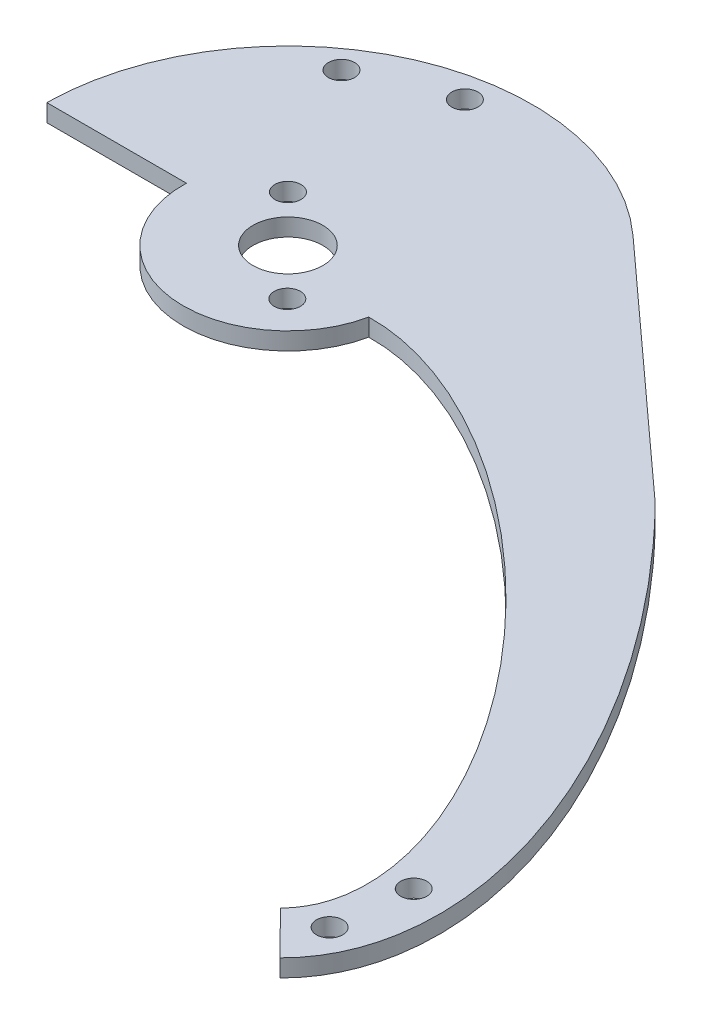
from build123d import *

# Parameters (mm, degrees)
SKETCH_1_R          = 4
SKETCH_1_R_2        = 1.5
EXTRUDE_1_DEPTH     = 2
SKETCH_2_R          = 1.5
CUT_EXTRUDE_2_DEPTH = 104.45632216


with BuildPart() as part:
    # Эскиз1 → Бобышка-Вытянуть1 (new body)
    with BuildSketch(Plane(origin=(0, 0, 0), x_dir=(1, 0, 0), z_dir=(0, 1, 0))):
        with BuildLine():
            Line((-11.994516295, 0.362737998), (-27.997650279, 0.362737998))
            ThreePointArc((-27.997650279, 0.362737998), (-19.670324553, 19.926824433), (0, 28))
            ThreePointArc((0, 28), (10.092907112, 26.117680334), (18.828808684, 20.72380186))
            Line((18.828808684, 20.72380186), (46.640586318, -4.544855106))
            add(Edge.make_bspline(
                [(70.251159119, -71.167230117), (91.601328154, -50.091882381), (46.640586318, -4.544855106)],
                knots=[0, 0, 0, 1.570796327, 1.570796327, 1.570796327], degree=2, weights=[1, 0.707106781, 1]))
            Line((70.251159119, -71.167230117), (65.33357798, -66.185524008))
            add(Edge.make_bspline(
                [(65.33357798, -66.185524008), (75.934017862, -55.721533944), (53.361603781, -28.88759026), (30.789189701, -2.053646576), (11.741792344, -2.475946799)],
                knots=[3.141592654, 3.141592654, 3.141592654, 4.52417168, 4.52417168, 5.906750707, 5.906750707, 5.906750707], degree=2, weights=[1, 0.770424551, 1, 0.770424551, 1]))
            ThreePointArc((11.741792344, -2.475946799), (-1.424956207, -11.915095459), (-11.994516295, 0.362737998))
        make_face()
        with Locations(Location((0, 0, 0), (0, 0, 270))):
            Circle(SKETCH_1_R, mode=Mode.SUBTRACT)
        with Locations(Location((-5.303300859, 5.303300859, 0), (0, 0, 270))):
            Circle(SKETCH_1_R_2, mode=Mode.SUBTRACT)
        with Locations(Location((5.268836934, -5.337542259, 0), (0, 0, 270))):
            Circle(SKETCH_1_R_2, mode=Mode.SUBTRACT)
    extrude(amount=EXTRUDE_1_DEPTH)

    # Эскиз2 → Вырез-Вытянуть2 (cut, through all)
    with BuildSketch(Plane(origin=(0, 2, 0), x_dir=(1, 0, 0), z_dir=(0, 1, 0))):
        with Locations(Location((-4.341204442, 24.620193825, 0), (0, 0, 270))):
            Circle(SKETCH_2_R)
        with Locations(Location((-14.339410909, 20.478801107, 0), (0, 0, 90))):
            Circle(SKETCH_2_R)
        with Locations(Location((71.061271843, -56.642637717, 0), (0, 0, 270))):
            Circle(SKETCH_2_R)
        with Locations(Location((70.06757808, -65.291253027, 0), (0, 0, 270))):
            Circle(SKETCH_2_R)
    extrude(amount=-CUT_EXTRUDE_2_DEPTH, mode=Mode.SUBTRACT)


solid = part.part
